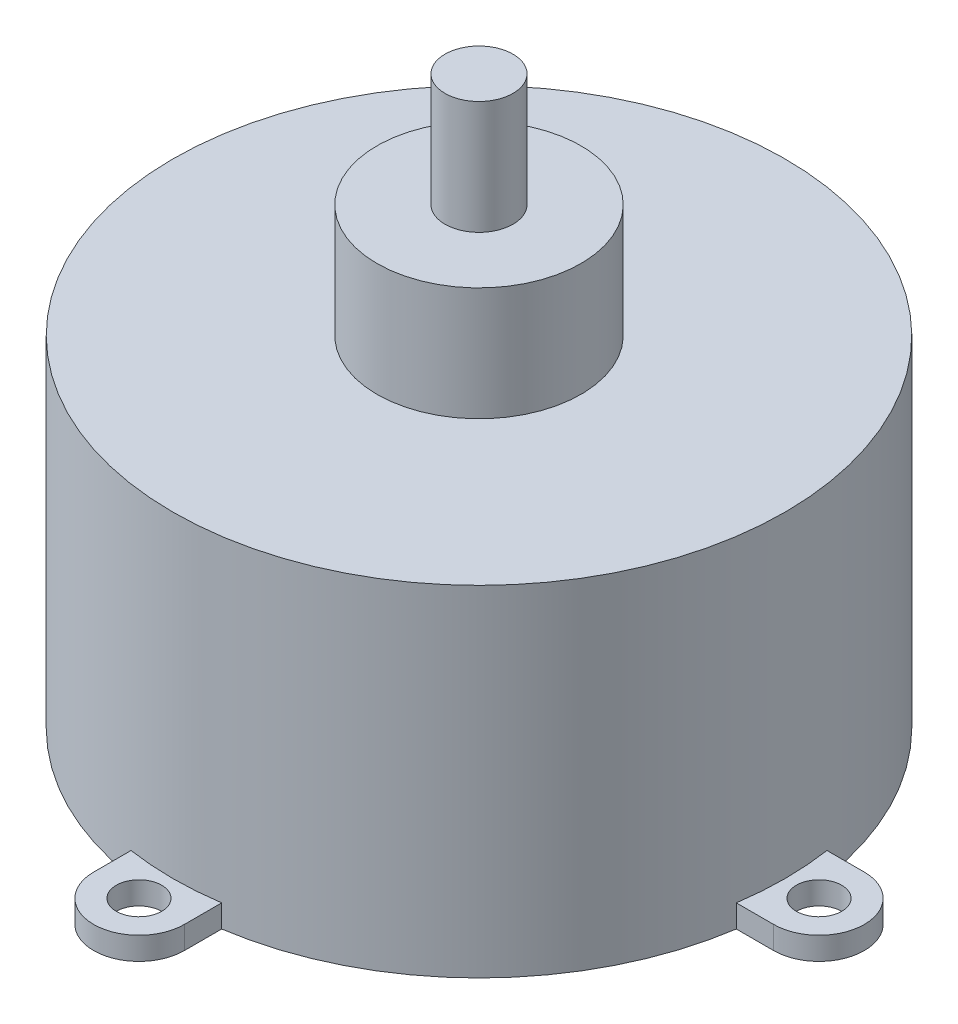
from build123d import *

# Parameters (mm, degrees)
SKETCH1_R           = 1.5
BOSS_EXTRUDE6_DEPTH = 25
SKETCH1_9_R         = 4.5
SKETCH1_9_R_2       = 1.5
BOSS_EXTRUDE7_DEPTH = 20
SKETCH1_10_R        = 13.5
SKETCH1_10_R_2      = 4.5
BOSS_EXTRUDE8_DEPTH = 15
SKETCH1_12_R        = 1
BOSS_EXTRUDE9_DEPTH = 1


with BuildPart() as part:
    # Sketch1 → Boss-Extrude6 (new body)
    with BuildSketch(Plane(origin=(0, 0, 0), x_dir=(1, 0, 0), z_dir=(0, 1, 0))):
        Circle(SKETCH1_R)
    extrude(amount=BOSS_EXTRUDE6_DEPTH)

    # Sketch1<9> → Boss-Extrude7 (add)
    with BuildSketch(Plane(origin=(0, 0, 0), x_dir=(1, 0, 0), z_dir=(0, 1, 0))):
        Circle(SKETCH1_9_R)
        Circle(SKETCH1_9_R_2, mode=Mode.SUBTRACT)
    extrude(amount=BOSS_EXTRUDE7_DEPTH)

    # Sketch1<10> → Boss-Extrude8 (add)
    with BuildSketch(Plane(origin=(0, 0, 0), x_dir=(1, 0, 0), z_dir=(0, 1, 0))):
        Circle(SKETCH1_10_R)
        Circle(SKETCH1_10_R_2, mode=Mode.SUBTRACT)
    extrude(amount=BOSS_EXTRUDE8_DEPTH)

    # Sketch1<12> → Boss-Extrude9 (add)
    # profile 1 of 4: a face of its own
    with BuildSketch(Plane(origin=(0, 0, 0), x_dir=(1, 0, 0), z_dir=(0, 1, 0))):
        with BuildLine():
            Line((2, 13.351029923), (2, 15))
            ThreePointArc((2, 15), (0, 17), (-2, 15))
            Line((-2, 15), (-2, 13.351029923))
            ThreePointArc((-2, 13.351029923), (0, 13.5), (2, 13.351029923))
        make_face()
        with Locations((0, 15)):
            Circle(SKETCH1_12_R, mode=Mode.SUBTRACT)
    # profile 2 of 4: a face of its own
    with BuildSketch(Plane(origin=(0, 0, 0), x_dir=(1, 0, 0), z_dir=(0, 1, 0))):
        with BuildLine():
            Line((15, 2), (13.351029923, 2))
            ThreePointArc((13.351029923, 2), (13.5, 0), (13.351029923, -2))
            Line((13.351029923, -2), (15, -2))
            ThreePointArc((15, -2), (17, 0), (15, 2))
        make_face()
        with Locations((15, 0)):
            Circle(SKETCH1_12_R, mode=Mode.SUBTRACT)
    # profile 3 of 4: a face of its own
    with BuildSketch(Plane(origin=(0, 0, 0), x_dir=(1, 0, 0), z_dir=(0, 1, 0))):
        with BuildLine():
            ThreePointArc((-13.351029923, -2), (-13.5, 0), (-13.351029923, 2))
            Line((-13.351029923, 2), (-15, 2))
            ThreePointArc((-15, 2), (-17, 0), (-15, -2))
            Line((-15, -2), (-13.351029923, -2))
        make_face()
        with Locations((-15, 0)):
            Circle(SKETCH1_12_R, mode=Mode.SUBTRACT)
    # profile 4 of 4: a face of its own
    with BuildSketch(Plane(origin=(0, 0, 0), x_dir=(1, 0, 0), z_dir=(0, 1, 0))):
        with BuildLine():
            Line((2, -15), (2, -13.351029923))
            ThreePointArc((2, -13.351029923), (0, -13.5), (-2, -13.351029923))
            Line((-2, -13.351029923), (-2, -15))
            ThreePointArc((-2, -15), (0, -17), (2, -15))
        make_face()
        with Locations((0, -15)):
            Circle(SKETCH1_12_R, mode=Mode.SUBTRACT)
    extrude(amount=BOSS_EXTRUDE9_DEPTH)


solid = part.part
